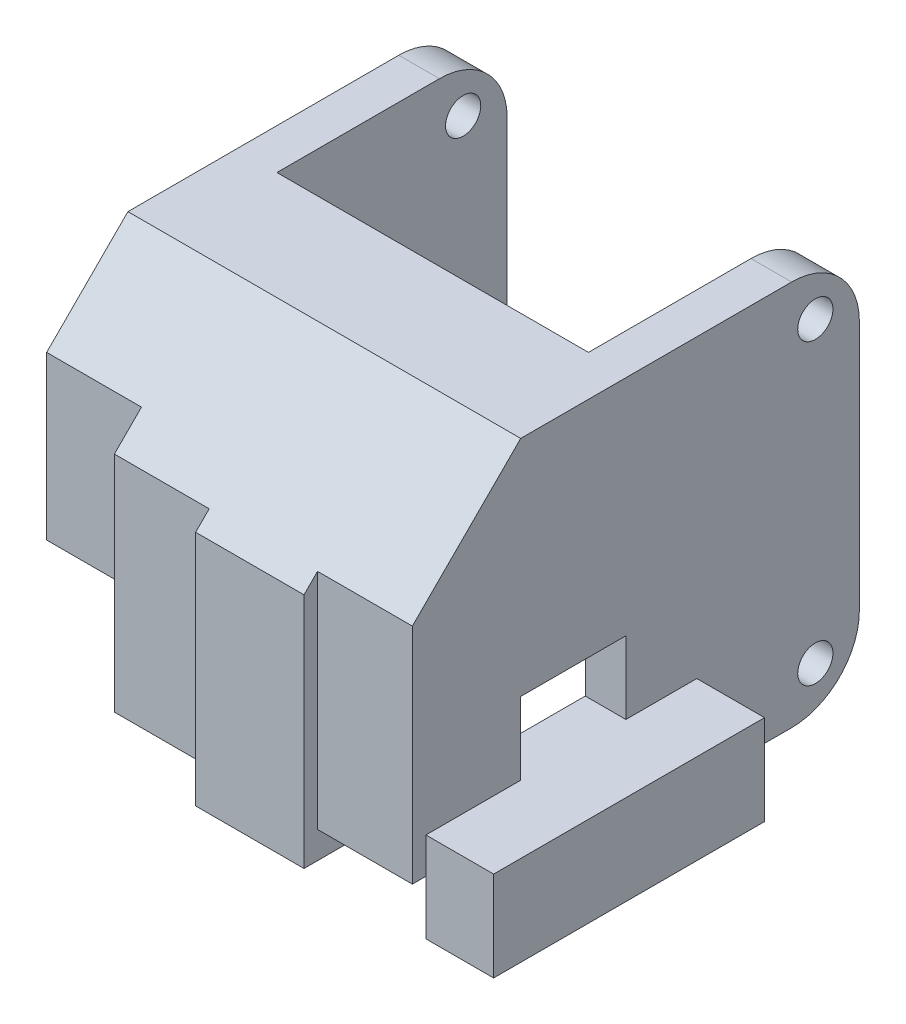
from build123d import *

# Parameters (mm, degrees)
SKETCH1_W           = 29
SKETCH1_H           = 28.5
BOSS_EXTRUDE1_DEPTH = 25
SKETCH2_R           = 1.3
CUT_EXTRUDE1_DEPTH  = 41.854161355
FILLET1_R           = 5
SKETCH3_W           = 23
SKETCH3_H           = 28.5
CUT_EXTRUDE2_DEPTH  = 17
SKETCH5_W           = 7
SKETCH5_H           = 18
BOSS_EXTRUDE2_DEPTH = 6
SKETCH6_W           = 7
SKETCH6_H           = 24.5
BOSS_EXTRUDE3_DEPTH = 8
SKETCH8_W           = 8
SKETCH8_H           = 26.5
BOSS_EXTRUDE4_DEPTH = 9
SKETCH9_W           = 7
SKETCH9_H           = 24.5
BOSS_EXTRUDE5_DEPTH = 8
CUT_EXTRUDE5_DEPTH  = 31
SKETCH11_W          = 20
SKETCH11_H          = 6.645872657
BOSS_EXTRUDE6_DEPTH = 5
SKETCH14_W          = 15
SKETCH14_H          = 12
CUT_EXTRUDE8_DEPTH  = 26
SKETCH15_W          = 7.764432238
SKETCH15_H          = 5.354127343
CUT_EXTRUDE9_DEPTH  = 25
SKETCH16_W          = 15
SKETCH16_H          = 4
CUT_EXTRUDE11_DEPTH = 26


with BuildPart() as part:
    # Sketch1 → Boss-Extrude1 (new body)
    with BuildSketch(Plane.XY):
        Rectangle(SKETCH1_W, SKETCH1_H)
    extrude(amount=BOSS_EXTRUDE1_DEPTH)

    # Sketch2 → Cut-Extrude1 (cut, through all)
    with BuildSketch(Plane(origin=(14.5, 0, 0), x_dir=(0, 0, -1), z_dir=(1, 0, 0))):
        with Locations(Location((-3.25, 11, 0), (0, 0, 90))):
            Circle(SKETCH2_R)
        with Locations(Location((-3.25, -11, 0), (0, 0, 90))):
            Circle(SKETCH2_R)
    extrude(amount=-CUT_EXTRUDE1_DEPTH, mode=Mode.SUBTRACT)

    # Fillet1
    fillet1_edges = [part.edges().sort_by_distance(p)[0] for p in [
        (0, -14.25, 0),
        (0, 14.25, 0),
    ]]
    fillet(fillet1_edges, radius=FILLET1_R)

    # Sketch3 → Cut-Extrude2 (cut)
    with BuildSketch(Plane(origin=(0, 0, 0), x_dir=(-1, 0, 0), z_dir=(0, 0, -1))):
        Rectangle(SKETCH3_W, SKETCH3_H)
    extrude(amount=-CUT_EXTRUDE2_DEPTH, mode=Mode.SUBTRACT)

    # Sketch5 → Boss-Extrude2 (add)
    with BuildSketch(Plane.XY.offset(25)):
        with Locations((-11, 5.25)):
            Rectangle(SKETCH5_W, SKETCH5_H)
    extrude(amount=BOSS_EXTRUDE2_DEPTH)

    # Sketch6 → Boss-Extrude3 (add)
    with BuildSketch(Plane.XY.offset(25)):
        with Locations((-4, 2)):
            Rectangle(SKETCH6_W, SKETCH6_H)
    extrude(amount=BOSS_EXTRUDE3_DEPTH)

    # Sketch8 → Boss-Extrude4 (add)
    with BuildSketch(Plane.XY.offset(25)):
        with Locations((3.5, 1)):
            Rectangle(SKETCH8_W, SKETCH8_H)
    extrude(amount=BOSS_EXTRUDE4_DEPTH)

    # Sketch9 → Boss-Extrude5 (add)
    with BuildSketch(Plane.XY.offset(25)):
        with Locations((11, 2)):
            Rectangle(SKETCH9_W, SKETCH9_H)
    extrude(amount=BOSS_EXTRUDE5_DEPTH)

    # Sketch10 → Cut-Extrude5 (cut)
    with BuildSketch(Plane(origin=(14.5, 0, 0), x_dir=(0, 0, -1), z_dir=(1, 0, 0))):
        Polygon((-33, 6.25), (-25, 14.25), (-33, 14.25), align=None)
        Polygon((-34, 5.25), (-33, 6.25), (-33, 14.25), (-34, 14.25), align=None)
    extrude(amount=-CUT_EXTRUDE5_DEPTH, mode=Mode.SUBTRACT)

    # Sketch11 → Boss-Extrude6 (add)
    with BuildSketch(Plane(origin=(14.5, 0, 0), x_dir=(0, 0, -1), z_dir=(1, 0, 0))):
        with Locations((-22, -10.927063672)):
            Rectangle(SKETCH11_W, SKETCH11_H)
    extrude(amount=BOSS_EXTRUDE6_DEPTH)

    # Sketch14 → Cut-Extrude8 (cut)
    with BuildSketch(Plane.ZY.offset(14.5)):
        with Locations((17.5, -8.25)):
            Rectangle(SKETCH14_W, SKETCH14_H)
    extrude(amount=-CUT_EXTRUDE8_DEPTH, mode=Mode.SUBTRACT)

    # Sketch15 → Cut-Extrude9 (cut)
    with BuildSketch(Plane.ZY.offset(-11.5)):
        with Locations((21.117783881, -4.927063672)):
            Rectangle(SKETCH15_W, SKETCH15_H)
    extrude(amount=-CUT_EXTRUDE9_DEPTH, mode=Mode.SUBTRACT)

    # Sketch16 → Cut-Extrude11 (cut)
    with BuildSketch(Plane.ZY.offset(14.5)):
        with Locations((17.5, -0.25)):
            Rectangle(SKETCH16_W, SKETCH16_H)
    extrude(amount=-CUT_EXTRUDE11_DEPTH, mode=Mode.SUBTRACT)


solid = part.part
